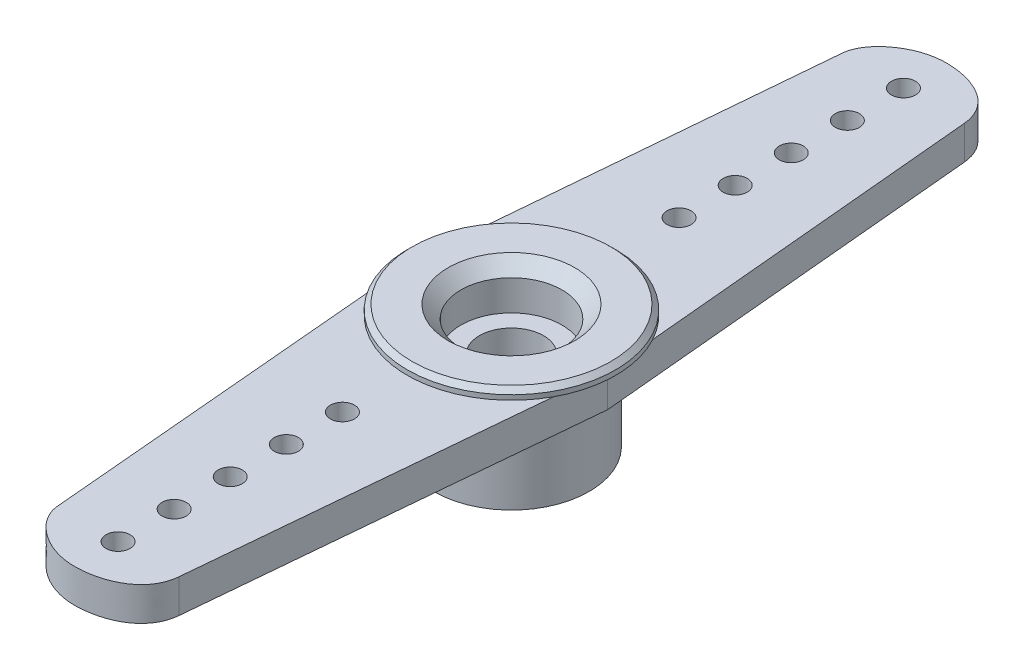
from build123d import *

# Parameters (mm, degrees)
SKETCH1_R           = 4.85
BASE_DEPTH          = 5
SKETCH2_R           = 0.75
SKETCH2_R_2         = 4.85
SKETCH2_R_3         = 3.15
BOSS_EXTRUDE2_DEPTH = 2.1
SKETCH3_R           = 6.5
SKETCH3_R_2         = 3.15
BOSS_EXTRUDE3_DEPTH = 0.6
CHAMFER1_SIZE       = 0.8
CHAMFER2_SIZE       = 0.3
CUT_EXTRUDE1_DEPTH  = 3
CIRPATTERN1_COUNT   = 26
SKETCH5_R           = 2.65
CUT_EXTRUDE2_DEPTH  = 3
SKETCH6_R           = 2
CUT_EXTRUDE3_DEPTH  = 3


with BuildPart() as part:
    # Sketch1 → Base (new body)
    with BuildSketch(Plane(origin=(0, 0, 0), x_dir=(1, 0, 0), z_dir=(0, 1, 0))):
        with Locations(Location((0, 0, 0), (0, 0, 270))):
            Circle(SKETCH1_R)
    extrude(amount=BASE_DEPTH)

    # Sketch4 → Cut-Extrude1 (cut)
    with BuildSketch(Plane.XZ):
        with BuildLine():
            Line((-0.262681209, -2.636948726), (0, -2.95))
            Line((0, -2.95), (0.262681209, -2.636948726))
            ThreePointArc((0.262681209, -2.636948726), (0, -2.65), (-0.262681209, -2.636948726))
        make_face()
    cut_extrude1 = extrude(amount=-CUT_EXTRUDE1_DEPTH, mode=Mode.SUBTRACT)

    # CirPattern1: Cut-Extrude1 ×26 about axis
    cirpattern1_axis = Axis((0, 0, 0), (0, 1, 0))
    for i in range(1, CIRPATTERN1_COUNT):
        add(cut_extrude1.rotate(cirpattern1_axis, i * 360 / CIRPATTERN1_COUNT), mode=Mode.SUBTRACT)

    # Sketch5 → Cut-Extrude2 (cut)
    with BuildSketch(Plane.XZ):
        Circle(SKETCH5_R)
    extrude(amount=-CUT_EXTRUDE2_DEPTH, mode=Mode.SUBTRACT)

    # Sketch6 → Cut-Extrude3 (cut)
    with BuildSketch(Plane.XZ.offset(-3)):
        with Locations(Location((0, 0, 0), (0, 0, 270))):
            Circle(SKETCH6_R)
    extrude(amount=-CUT_EXTRUDE3_DEPTH, mode=Mode.SUBTRACT)


with BuildPart() as body_2:
    # Sketch2 → Boss-Extrude2 (new body)
    # profile 1 of 2: a face of its own
    with BuildSketch(Plane(origin=(0, 5, 0), x_dir=(1, 0, 0), z_dir=(0, 1, 0))):
        with BuildLine():
            Line((3.754897555, -24.5), (6, 0))
            Line((6, 0), (3.754897555, 24.5))
            add(Edge.make_bspline(
                [(-3.845102445, 24.48600504), (-3.734781319, 25.740734056), (-1.898564179, 27.229613074), (1.798625564, 27.191534839), (3.606306924, 26.121516409), (3.754897555, 24.5)],
                knots=[0, 0, 0, 0, 0.45, 0.55, 1, 1, 1, 1], degree=3))
            Line((-3.845102445, 24.48600504), (-5.998016427, 0))
            Line((-5.998016427, 0), (-3.845102445, -24.48600504))
            add(Edge.make_bspline(
                [(-3.845102445, -24.48600504), (-3.734781319, -25.740734056), (-1.898564179, -27.229613074), (1.798625564, -27.191534839), (3.606306924, -26.121516409), (3.754897555, -24.5)],
                knots=[0, 0, 0, 0, 0.45, 0.55, 1, 1, 1, 1], degree=3))
        make_face()
        with Locations(Location((-0.04511533, -24.5, 0), (0, 0, 270))):
            Circle(SKETCH2_R, mode=Mode.SUBTRACT)
        with Locations(Location((-0.04511533, -21, 0), (0, 0, 270))):
            Circle(SKETCH2_R, mode=Mode.SUBTRACT)
        with Locations(Location((-0.04511533, -17.5, 0), (0, 0, 270))):
            Circle(SKETCH2_R, mode=Mode.SUBTRACT)
        with Locations(Location((-0.04511533, -14, 0), (0, 0, 270))):
            Circle(SKETCH2_R, mode=Mode.SUBTRACT)
        with Locations(Location((-0.04511533, -10.5, 0), (0, 0, 270))):
            Circle(SKETCH2_R, mode=Mode.SUBTRACT)
        with Locations(Location((0, 0, 0), (0, 0, 270))):
            Circle(SKETCH2_R_2, mode=Mode.SUBTRACT)
        with Locations(Location((-0.04511533, 10.5, 0), (0, 0, 270))):
            Circle(SKETCH2_R, mode=Mode.SUBTRACT)
        with Locations(Location((-0.04511533, 14, 0), (0, 0, 270))):
            Circle(SKETCH2_R, mode=Mode.SUBTRACT)
        with Locations(Location((-0.04511533, 17.5, 0), (0, 0, 270))):
            Circle(SKETCH2_R, mode=Mode.SUBTRACT)
        with Locations(Location((-0.04511533, 21, 0), (0, 0, 270))):
            Circle(SKETCH2_R, mode=Mode.SUBTRACT)
        with Locations(Location((-0.04511533, 24.5, 0), (0, 0, 270))):
            Circle(SKETCH2_R, mode=Mode.SUBTRACT)
    # profile 2 of 2: a face of its own
    with BuildSketch(Plane(origin=(0, 5, 0), x_dir=(1, 0, 0), z_dir=(0, 1, 0))):
        with Locations(Location((0, 0, 0), (0, 0, 270))):
            Circle(SKETCH2_R_2)
        with Locations(Location((0, 0, 0), (0, 0, 270))):
            Circle(SKETCH2_R_3, mode=Mode.SUBTRACT)
    extrude(amount=BOSS_EXTRUDE2_DEPTH)

    # Sketch3 → Boss-Extrude3 (add)
    with BuildSketch(Plane(origin=(0, 7.1, 0), x_dir=(1, 0, 0), z_dir=(0, 1, 0))):
        with Locations(Location((0, 0, 0), (0, 0, 28.422667101))):
            Circle(SKETCH3_R)
        with Locations(Location((0, 0, 0), (0, 0, 270))):
            Circle(SKETCH3_R_2, mode=Mode.SUBTRACT)
    extrude(amount=BOSS_EXTRUDE3_DEPTH)

    # Chamfer1
    chamfer1_edges = [body_2.edges().sort_by_distance(p)[0] for p in [
        (0, 7.7, -3.15),
    ]]
    chamfer(chamfer1_edges, length=CHAMFER1_SIZE)

    # Chamfer2
    chamfer2_edges = [body_2.edges().sort_by_distance(p)[0] for p in [
        (-5.716492208, 7.7, 3.093819134),
    ]]
    chamfer(chamfer2_edges, length=CHAMFER2_SIZE)


solid = Compound([part.part, body_2.part])
